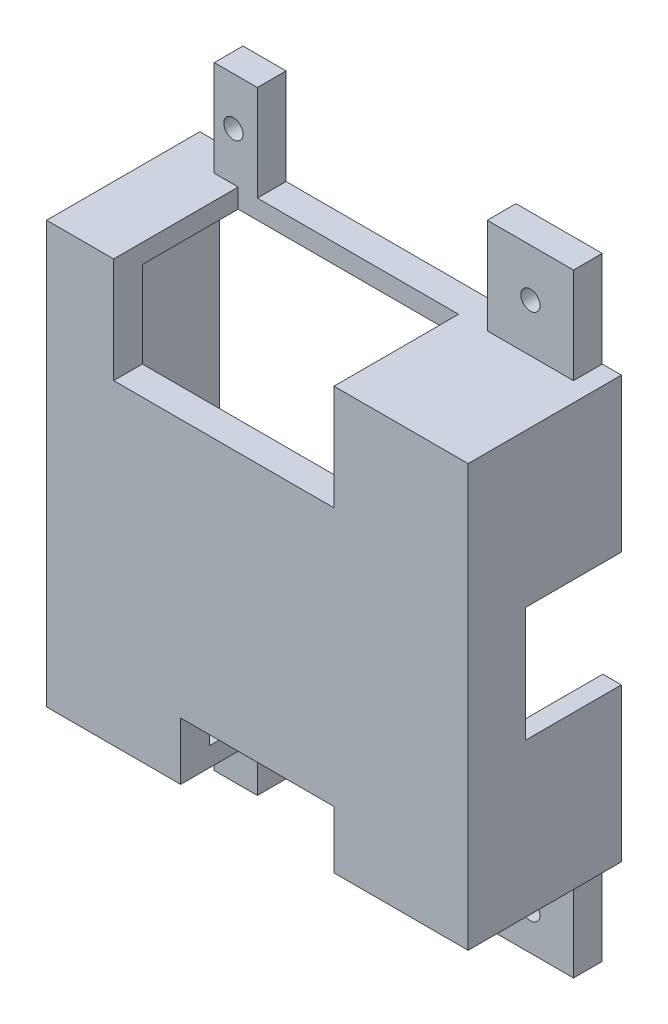
from build123d import *

# Parameters (mm, degrees)
SKETCH1_W           = 44
SKETCH1_H           = 44
BOSS_EXTRUDE1_DEPTH = 16
SKETCH3_W           = 40
SKETCH3_H           = 40
CUT_EXTRUDE1_DEPTH  = 13
SKETCH5_W           = 23
SKETCH5_H           = 11
CUT_EXTRUDE2_DEPTH  = 13
SKETCH6_W           = 16
SKETCH6_H           = 6
CUT_EXTRUDE3_DEPTH  = 10
SKETCH7_W           = 10
SKETCH7_H           = 12
CUT_EXTRUDE4_DEPTH  = 5
SKETCH8_W           = 4.5
SKETCH8_H           = 3
SKETCH8_W_2         = 9
BOSS_EXTRUDE2_DEPTH = 10
SKETCH9_R           = 1
CUT_EXTRUDE5_DEPTH  = 10
SKETCH10_W          = 9
SKETCH10_H          = 3
SKETCH10_W_2        = 4.5
BOSS_EXTRUDE3_DEPTH = 10
SKETCH11_R          = 1
CUT_EXTRUDE6_DEPTH  = 10


with BuildPart() as part:
    # Sketch1 → Boss-Extrude1 (new body)
    with BuildSketch(Plane.XY):
        with Locations((22, 22)):
            Rectangle(SKETCH1_W, SKETCH1_H)
    extrude(amount=BOSS_EXTRUDE1_DEPTH)

    # Sketch3 → Cut-Extrude1 (cut)
    with BuildSketch(Plane(origin=(0, 0, 0), x_dir=(-1, 0, 0), z_dir=(0, 0, -1))):
        with Locations((-22.063776274, 22)):
            Rectangle(SKETCH3_W, SKETCH3_H)
    extrude(amount=-CUT_EXTRUDE1_DEPTH, mode=Mode.SUBTRACT)

    # Sketch5 → Cut-Extrude2 (cut)
    with BuildSketch(Plane.XY.offset(16)):
        with Locations((18.5, 38.5)):
            Rectangle(SKETCH5_W, SKETCH5_H)
    extrude(amount=-CUT_EXTRUDE2_DEPTH, mode=Mode.SUBTRACT)

    # Sketch6 → Cut-Extrude3 (cut)
    with BuildSketch(Plane.XY.offset(16)):
        with Locations((22, 3)):
            Rectangle(SKETCH6_W, SKETCH6_H)
    extrude(amount=-CUT_EXTRUDE3_DEPTH, mode=Mode.SUBTRACT)

    # Sketch7 → Cut-Extrude4 (cut)
    with BuildSketch(Plane(origin=(44, 0, 0), x_dir=(0, 0, -1), z_dir=(1, 0, 0))):
        with Locations((-5, 22)):
            Rectangle(SKETCH7_W, SKETCH7_H)
    extrude(amount=-CUT_EXTRUDE4_DEPTH, mode=Mode.SUBTRACT)

    # Sketch8 → Boss-Extrude2 (add)
    with BuildSketch(Plane(origin=(0, 0, 0), x_dir=(-1, 0, 0), z_dir=(0, -1, 0))):
        with Locations((-6.75, -1.5)):
            Rectangle(SKETCH8_W, SKETCH8_H)
        with Locations((-37.5, -1.5)):
            Rectangle(SKETCH8_W_2, SKETCH8_H)
    extrude(amount=BOSS_EXTRUDE2_DEPTH)

    # Sketch9 → Cut-Extrude5 (cut)
    with BuildSketch(Plane.XY.offset(3)):
        with Locations((6.5, -6.077320914)):
            Circle(SKETCH9_R)
        with Locations((37.5, -6.077320914)):
            Circle(SKETCH9_R)
    extrude(amount=-CUT_EXTRUDE5_DEPTH, mode=Mode.SUBTRACT)

    # Sketch10 → Boss-Extrude3 (add)
    with BuildSketch(Plane(origin=(0, 44, 0), x_dir=(1, 0, 0), z_dir=(0, 1, 0))):
        with Locations((37.5, -1.5)):
            Rectangle(SKETCH10_W, SKETCH10_H)
        with Locations((6.75, -1.5)):
            Rectangle(SKETCH10_W_2, SKETCH10_H)
    extrude(amount=BOSS_EXTRUDE3_DEPTH)

    # Sketch11 → Cut-Extrude6 (cut)
    with BuildSketch(Plane.XY.offset(3)):
        with Locations((37.5, 49.031327524)):
            Circle(SKETCH11_R)
        with Locations((6.5, 49.031327524)):
            Circle(SKETCH11_R)
    extrude(amount=-CUT_EXTRUDE6_DEPTH, mode=Mode.SUBTRACT)


solid = part.part
